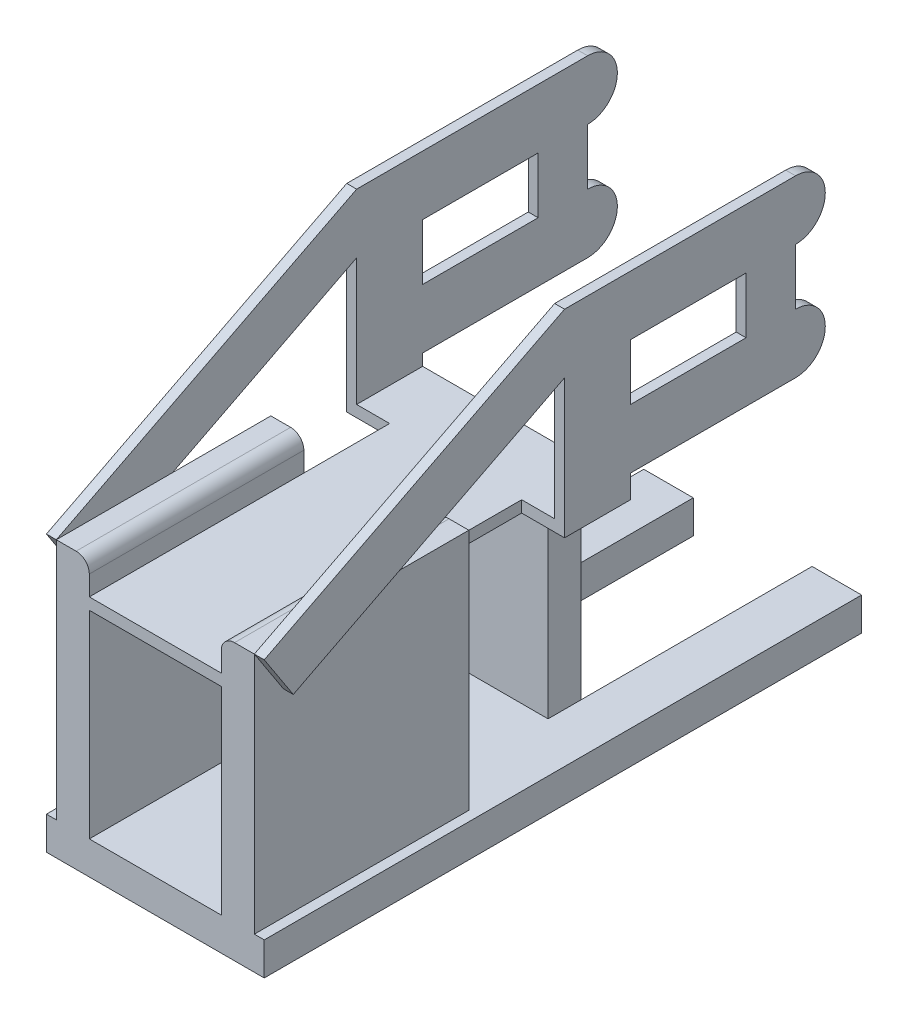
from build123d import *

# Parameters (mm, degrees)
SKETCH_1_W      = 60
SKETCH_1_H      = 3
EXTRUDE_1_DEPTH = 65
SKETCH_2_W      = 40
SKETCH_2_H      = 3.5
EXTRUDE_2_DEPTH = 46
EXTRUDE_3_DEPTH = 3.5
SKETCH_5_W      = 35
SKETCH_5_H      = 17
EXTRUDE_4_DEPTH = 3
EXTRUDE_START   = 3
SKETCH_6_W      = 35
SKETCH_6_H      = 17
SKETCH_6_W_2    = 20
SKETCH_6_H_2    = 3.5
EXTRUDE_5_DEPTH = 3
SKETCH_7_W      = 36
SKETCH_7_H      = 10
SKETCH_7_W_2    = 10
SKETCH_7_H_2    = 65
EXTRUDE_6_DEPTH = 60
SKETCH_8_W      = 66
SKETCH_8_H      = 111
EXTRUDE_7_DEPTH = 10
SKETCH_9_W      = 15
SKETCH_9_H      = 10
EXTRUDE_8_DEPTH = 70


with BuildPart() as part:
    # 草图1 → 凸台-拉伸1 (new body)
    with BuildSketch(Plane.XY):
        with Locations((0, -32)):
            Rectangle(SKETCH_1_W, SKETCH_1_H)
        with BuildLine():
            Line((-20, -24), (-20, -28))
            Line((-20, -28), (-20, -30))
            Line((-20, -30), (20, -30))
            Line((20, -30), (20, -28))
            Line((20, -28), (20, -24))
            ThreePointArc((20, -24), (21.171572875, -21.171572875), (24, -20))
            Line((24, -20), (28, -20))
            Line((28, -20), (30, -20))
            Line((30, -20), (30, -30.5))
            Line((30, -30.5), (-30, -30.5))
            Line((-30, -30.5), (-30, -20))
            Line((-30, -20), (-28, -20))
            Line((-28, -20), (-24, -20))
            ThreePointArc((-24, -20), (-21.171572875, -21.171572875), (-20, -24))
        make_face()
    extrude(amount=EXTRUDE_1_DEPTH)

    # 草图2 → 凸台-拉伸2 (add)
    with BuildSketch(Plane(origin=(0, 0, 0), x_dir=(-1, 0, 0), z_dir=(0, 0, -1))):
        with Locations((0, -31.75)):
            Rectangle(SKETCH_2_W, SKETCH_2_H)
    extrude(amount=EXTRUDE_2_DEPTH)

    # 草图4 → 凸台-拉伸3 (add)
    with BuildSketch(Plane.XZ.offset(33.5)):
        Polygon((20, -46), (30, -46), (30, -26), (20, -26), (-30, -26), (-30, -46), align=None)
    extrude(amount=-EXTRUDE_3_DEPTH)

    # 草图5 → 凸台-拉伸4 (add)
    with BuildSketch(Plane.ZY.offset(30)):
        with BuildLine():
            Line((-46, -26.5), (-46, -33.5))
            Line((-46, -33.5), (-26, -33.5))
            Line((-26, -33.5), (-26, 8.5))
            Line((-26, 8.5), (56.193548387, -33.5))
            Line((56.193548387, -33.5), (65, -20))
            Line((65, -20), (-26, 26.5))
            Line((-26, 26.5), (-96, 26.5))
            ThreePointArc((-96, 26.5), (-105, 17.5), (-96, 8.5))
            Line((-96, 8.5), (-96, -8.5))
            ThreePointArc((-96, -8.5), (-105, -17.5), (-96, -26.5))
            Line((-96, -26.5), (-46, -26.5))
        make_face()
        with Locations((-63.5, 0)):
            Rectangle(SKETCH_5_W, SKETCH_5_H, mode=Mode.SUBTRACT)
    extrude(amount=EXTRUDE_4_DEPTH)

    # 草图6 → 凸台-拉伸5 (add)
    # profile 1 of 3: a face of its own
    with BuildSketch(Plane(origin=(30, 0, 0), x_dir=(0, 0, -1), z_dir=(1, 0, 0)).offset(EXTRUDE_START)):
        Polygon((26, 8.5), (26, 26.5), (-65, -20), (-56.193548387, -33.5), align=None)
    # profile 2 of 3: a face of its own
    with BuildSketch(Plane(origin=(30, 0, 0), x_dir=(0, 0, -1), z_dir=(1, 0, 0)).offset(EXTRUDE_START)):
        with BuildLine():
            Line((96, 26.5), (46, 26.5))
            Line((46, 26.5), (26, 26.5))
            Line((26, 26.5), (26, 8.5))
            Line((26, 8.5), (26, -30))
            Line((26, -30), (46, -30))
            Line((46, -30), (46, -26.5))
            Line((46, -26.5), (96, -26.5))
            ThreePointArc((96, -26.5), (105, -17.5), (96, -8.5))
            Line((96, -8.5), (96, 8.5))
            ThreePointArc((96, 8.5), (105, 17.5), (96, 26.5))
        make_face()
        with Locations((63.5, 0)):
            Rectangle(SKETCH_6_W, SKETCH_6_H, mode=Mode.SUBTRACT)
    # profile 3 of 3: a face of its own
    with BuildSketch(Plane(origin=(30, 0, 0), x_dir=(0, 0, -1), z_dir=(1, 0, 0)).offset(EXTRUDE_START)):
        with Locations((36, -31.75)):
            Rectangle(SKETCH_6_W_2, SKETCH_6_H_2)
    extrude(amount=-EXTRUDE_5_DEPTH)

    # 草图7 → 凸台-拉伸6 (add)
    with BuildSketch(Plane.XZ.offset(33.5)):
        with Locations((0, -41)):
            Rectangle(SKETCH_7_W, SKETCH_7_H)
        with Locations((-25, 32.5)):
            Rectangle(SKETCH_7_W_2, SKETCH_7_H_2)
        with Locations((25, 32.5)):
            Rectangle(SKETCH_7_W_2, SKETCH_7_H_2)
    extrude(amount=EXTRUDE_6_DEPTH)

    # 草图8 → 凸台-拉伸7 (add)
    with BuildSketch(Plane.XZ.offset(93.5)):
        with Locations((0, 9.5)):
            Rectangle(SKETCH_8_W, SKETCH_8_H)
    extrude(amount=EXTRUDE_7_DEPTH)

    # 草图9 → 凸台-拉伸8 (add)
    with BuildSketch(Plane(origin=(0, 0, -46), x_dir=(-1, 0, 0), z_dir=(0, 0, -1))):
        with Locations((25.5, -98.5)):
            Rectangle(SKETCH_9_W, SKETCH_9_H)
        with Locations((-25.5, -98.5)):
            Rectangle(SKETCH_9_W, SKETCH_9_H)
    extrude(amount=EXTRUDE_8_DEPTH)


solid = part.part
